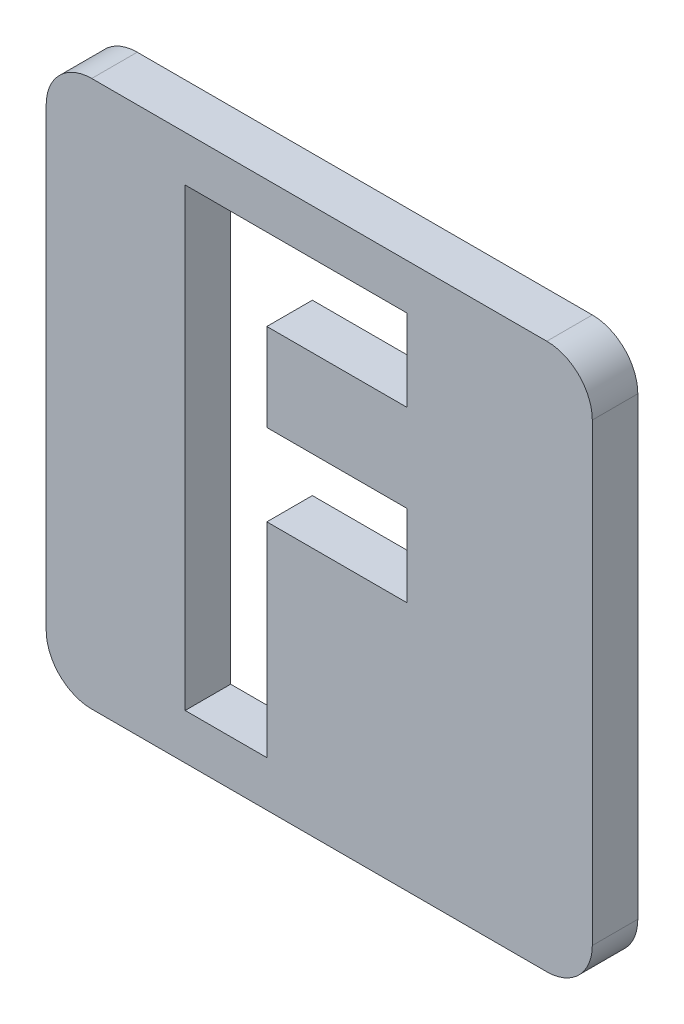
from build123d import *

# Parameters (mm, degrees)
BOSS_EXTRUDE1_DEPTH = 10
CUT_EXTRUDE19_DEPTH = 10


with BuildPart() as part:
    # Sketch1 → Boss-Extrude1 (new body)
    with BuildSketch(Plane.XY):
        with BuildLine():
            Line((-50, 60), (50, 60))
            ThreePointArc((50, 60), (57.071067812, 57.071067812), (60, 50))
            Line((60, 50), (60, -50))
            ThreePointArc((60, -50), (57.071067812, -57.071067812), (50, -60))
            Line((50, -60), (-50, -60))
            ThreePointArc((-50, -60), (-57.071067812, -57.071067812), (-60, -50))
            Line((-60, -50), (-60, 50))
            ThreePointArc((-60, 50), (-57.071067812, 57.071067812), (-50, 60))
        make_face()
    extrude(amount=BOSS_EXTRUDE1_DEPTH)

    # Sketch2 → Cut-Extrude19 (cut)
    with BuildSketch(Plane.XY.offset(10)):
        Polygon((-29.461538462, 50), (19.256410256, 50), (19.256410256, 32.051282051), (-11.512820513, 32.051282051), (-11.512820513, 12.820512821), (19.256410256, 12.820512821), (19.256410256, -5.128205128), (-11.512820513, -5.128205128), (-11.512820513, -50), (-29.461538462, -50), align=None)
    extrude(amount=-CUT_EXTRUDE19_DEPTH, mode=Mode.SUBTRACT)


solid = part.part
